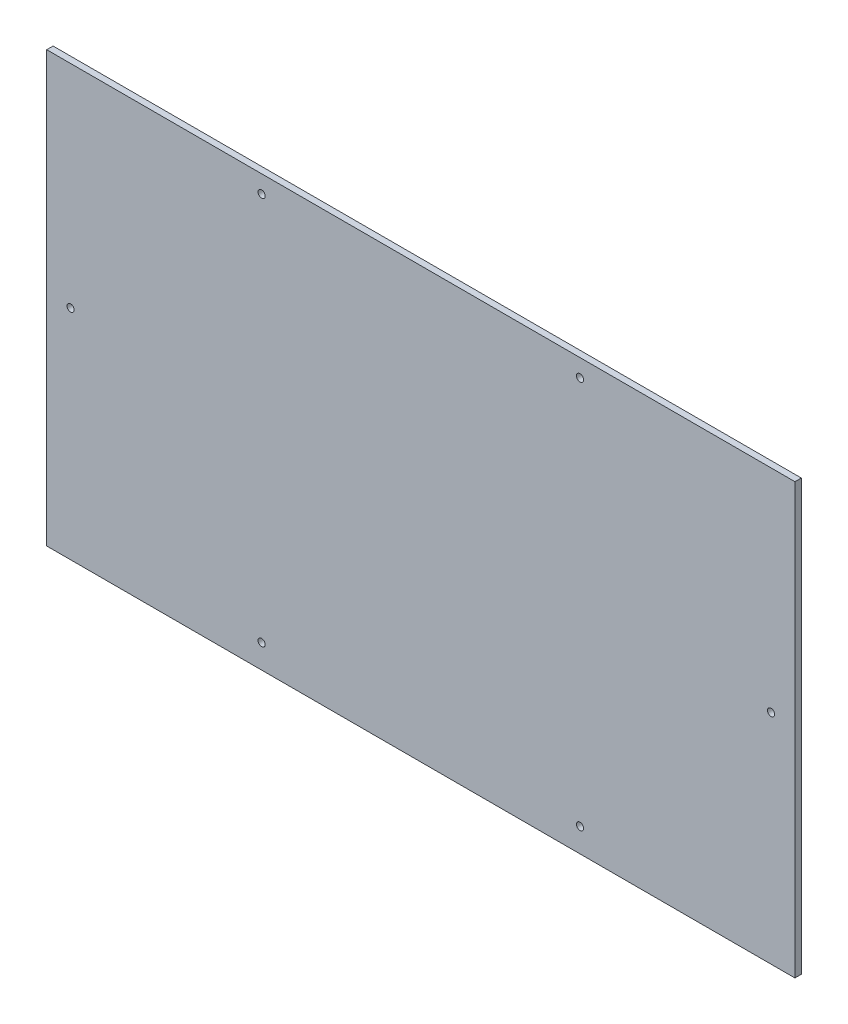
from build123d import *

# Parameters (mm, degrees)
SKETCH1_W           = 470
SKETCH1_H           = 270
BOSS_EXTRUDE1_DEPTH = 2
SKETCH2_R           = 2.25
CUT_EXTRUDE1_DEPTH  = 358.967875654


with BuildPart() as part:
    # Sketch1 → Boss-Extrude1 (new, symmetric)
    with BuildSketch(Plane.XY):
        with Locations((0, -135)):
            Rectangle(SKETCH1_W, SKETCH1_H)
    extrude(amount=BOSS_EXTRUDE1_DEPTH, both=True)

    # Sketch2 → Cut-Extrude1 (cut, through all)
    with BuildSketch(Plane.XY.offset(2)):
        with Locations((-220, -133)):
            Circle(SKETCH2_R)
        with Locations((-100, -11)):
            Circle(SKETCH2_R)
        with Locations((-100, -255)):
            Circle(SKETCH2_R)
        with Locations(Location((220, -133, 0), (0, 0, 180))):
            Circle(SKETCH2_R)
        with Locations(Location((100, -255, 0), (0, 0, 180))):
            Circle(SKETCH2_R)
        with Locations(Location((100, -11, 0), (0, 0, 180))):
            Circle(SKETCH2_R)
    extrude(amount=-CUT_EXTRUDE1_DEPTH, mode=Mode.SUBTRACT)


solid = part.part
